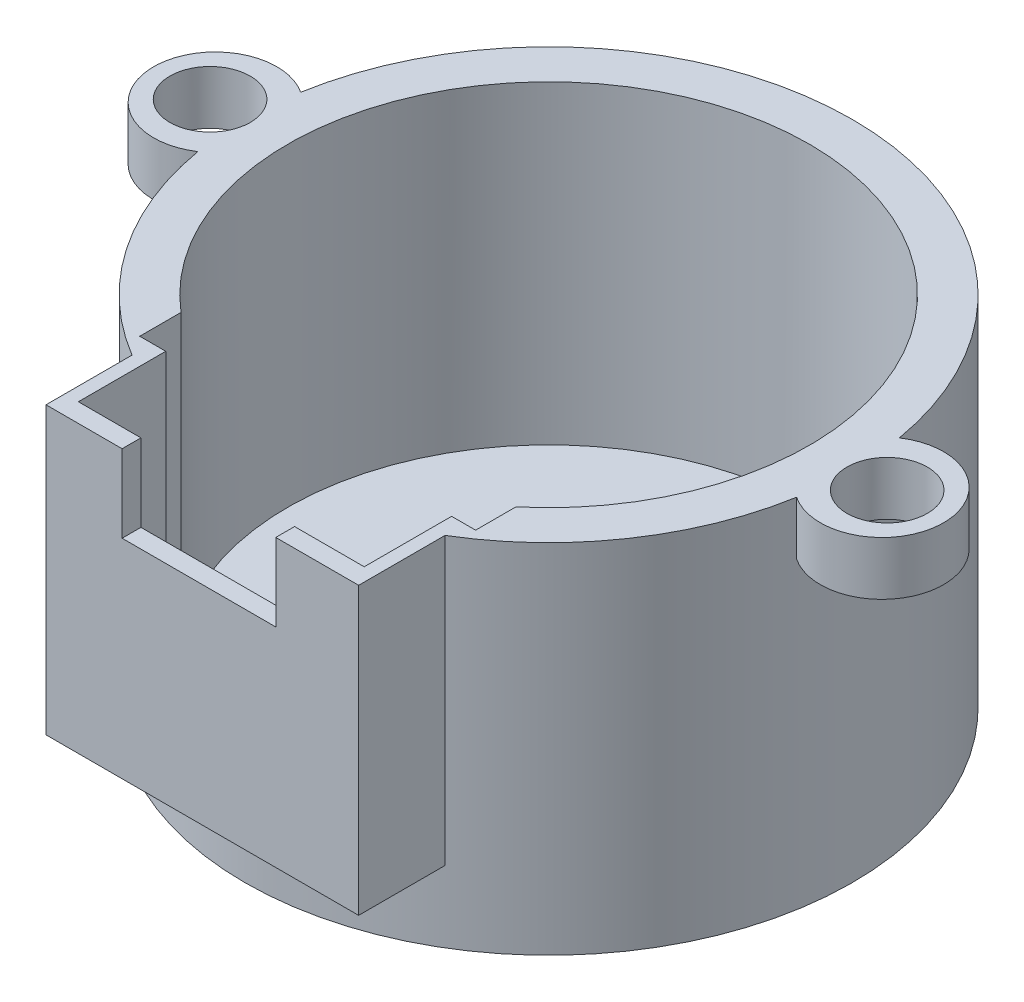
from build123d import *

# Parameters (mm, degrees)
SKETCH1_R           = 17
BOSS_EXTRUDE1_DEPTH = 20
SHELL1_T            = -2.4
SKETCH2_R           = 3.45
BOSS_EXTRUDE3_DEPTH = 3
SKETCH4_R           = 2.25
CUT_EXTRUDE1_DEPTH  = 3
SKETCH5_W           = 17.5
SKETCH5_H           = 7.7
BOSS_EXTRUDE4_DEPTH = 16
SKETCH6_W           = 16
SKETCH6_H           = 8.6
CUT_EXTRUDE2_DEPTH  = 14
SKETCH7_W           = 8.6
SKETCH7_H           = 5.8
CUT_EXTRUDE3_DEPTH  = 5
FILLET4_R           = 1
SKETCH8_W           = 18.8
SKETCH8_H           = 3
CUT_EXTRUDE4_DEPTH  = 16


with BuildPart() as part:
    # Sketch1 → Boss-Extrude1 (new body)
    with BuildSketch(Plane(origin=(0, 0, 0), x_dir=(1, 0, 0), z_dir=(0, 1, 0))):
        with Locations(Location((0, 0, 0), (0, 0, 270))):
            Circle(SKETCH1_R)
    extrude(amount=BOSS_EXTRUDE1_DEPTH)

    # Shell1
    shell1_openings = [part.faces().sort_by_distance(p)[0] for p in [
        (0, 20, 0),
    ]]
    offset(amount=SHELL1_T, openings=shell1_openings, kind=Kind.INTERSECTION)

    # Sketch2 → Boss-Extrude3 (add)
    with BuildSketch(Plane(origin=(0, 20, 0), x_dir=(1, 0, 0), z_dir=(0, 1, 0))):
        with Locations((18.659372003, 0)):
            Circle(SKETCH2_R)
        with Locations((-18.659372003, 0)):
            Circle(SKETCH2_R)
    extrude(amount=-BOSS_EXTRUDE3_DEPTH)

    # Sketch4 → Cut-Extrude1 (cut)
    with BuildSketch(Plane(origin=(0, 20, 0), x_dir=(1, 0, 0), z_dir=(0, 1, 0))):
        with Locations(Location((18.95, 0, 0), (0, 0, 270))):
            Circle(SKETCH4_R)
        with Locations(Location((-18.95, 0, 0), (0, 0, 331.816850826))):
            Circle(SKETCH4_R)
    extrude(amount=-CUT_EXTRUDE1_DEPTH, mode=Mode.SUBTRACT)

    # Sketch5 → Boss-Extrude4 (add)
    with BuildSketch(Plane(origin=(0, 20, 0), x_dir=(1, 0, 0), z_dir=(0, 1, 0))):
        with Locations((0.01757968, -15.550633972)):
            Rectangle(SKETCH5_W, SKETCH5_H)
    extrude(amount=-BOSS_EXTRUDE4_DEPTH)

    # Sketch6 → Cut-Extrude2 (cut)
    with BuildSketch(Plane(origin=(0, 20, 0), x_dir=(1, 0, 0), z_dir=(0, 1, 0))):
        with Locations((0.025977535, -14.047647825)):
            Rectangle(SKETCH6_W, SKETCH6_H)
    extrude(amount=-CUT_EXTRUDE2_DEPTH, mode=Mode.SUBTRACT)

    # Sketch7 → Cut-Extrude3 (cut)
    with BuildSketch(Plane.XY.offset(19.400633972)):
        with Locations((-0.172487463, 18.560997168)):
            Rectangle(SKETCH7_W, SKETCH7_H)
    extrude(amount=-CUT_EXTRUDE3_DEPTH, mode=Mode.SUBTRACT)

    # Fillet4
    fillet4_edges = [part.edges().sort_by_distance(p)[0] for p in [
        (0, 4, 11.700633972),
    ]]
    fillet(fillet4_edges, radius=FILLET4_R)

    # Sketch8 → Cut-Extrude4 (cut)
    with BuildSketch(Plane(origin=(0, 20, 0), x_dir=(1, 0, 0), z_dir=(0, 1, 0))):
        with Locations((-0.031709419, -11.955798022)):
            Rectangle(SKETCH8_W, SKETCH8_H)
    extrude(amount=-CUT_EXTRUDE4_DEPTH, mode=Mode.SUBTRACT)


solid = part.part
